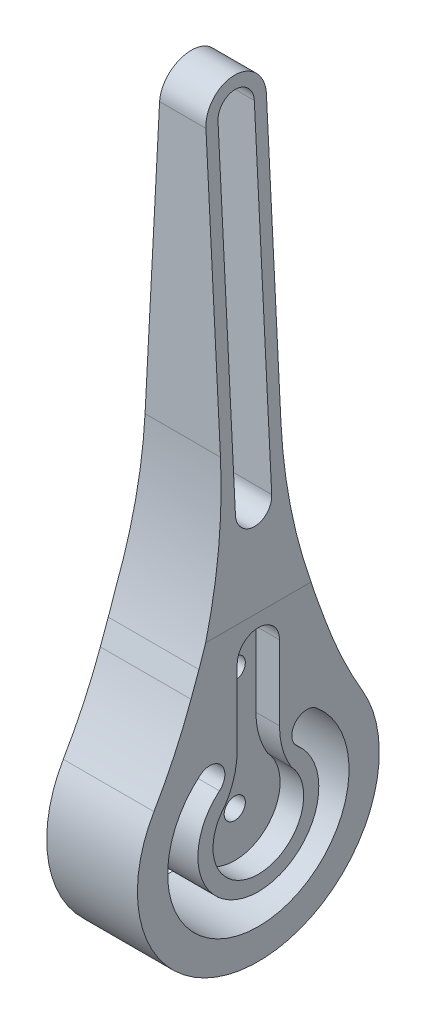
from build123d import *

# Parameters (mm, degrees)
BOSS_EXTRUDE1_DEPTH     = 15
CUT_EXTRUDE1_DEPTH      = 3.9
SKETCH4_R               = 1.75
CUT_EXTRUDE2_DEPTH      = 108.462598145
CUT_EXTRUDE3_DEPTH      = 108.935165725
CUT_EXTRUDE3_DEPTH_BACK = 108.935165725
CUT_EXTRUDE5_DEPTH      = 108.935165725


with BuildPart() as part:
    # Sketch2 → Boss-Extrude1 (new body)
    with BuildSketch(Plane.YZ):
        with BuildLine():
            Line((54.106158457, 5), (100, 5))
            ThreePointArc((100, 5), (105, 0), (100, -5))
            Line((100, -5), (54.106158457, -5))
            ThreePointArc((54.106158457, -5), (40.214304243, -6.215379759), (26.744546991, -9.824590337))
            Line((26.744546991, -9.824590337), (23.135674536, -11.13811249))
            ThreePointArc((23.135674536, -11.13811249), (16.479451078, -13.906430601), (10.0994572, -17.262704431))
            ThreePointArc((10.0994572, -17.262704431), (-20, 0), (10.0994572, 17.262704431))
            ThreePointArc((10.0994572, 17.262704431), (16.479451078, 13.906430601), (23.135674536, 11.13811249))
            Line((23.135674536, 11.13811249), (26.744546991, 9.824590337))
            ThreePointArc((26.744546991, 9.824590337), (40.214304243, 6.215379759), (54.106158457, 5))
        make_face()
        with BuildLine():
            Line((45, 3), (100, 3))
            ThreePointArc((100, 3), (103, 0), (100, -3))
            Line((100, -3), (45, -3))
            ThreePointArc((45, -3), (42, 0), (45, 3))
        make_face(mode=Mode.SUBTRACT)
    extrude(amount=-BOSS_EXTRUDE1_DEPTH)

    # Sketch3 → Cut-Extrude1 (cut)
    with BuildSketch(Plane.YZ):
        with BuildLine():
            Line((24.33053856, 3.5), (12, 3.5))
            ThreePointArc((12, 3.5), (8.440790603, 3.996719292), (5.153570125, 5.448918697))
            ThreePointArc((5.153570125, 5.448918697), (-7.5, 0), (5.153570125, -5.448918697))
            ThreePointArc((5.153570125, -5.448918697), (8.440790603, -3.996719292), (12, -3.5))
            Line((12, -3.5), (24.33053856, -3.5))
            ThreePointArc((24.33053856, -3.5), (27.83053856, 0), (24.33053856, 3.5))
        make_face()
    extrude(amount=-CUT_EXTRUDE1_DEPTH, mode=Mode.SUBTRACT)

    # Sketch4 → Cut-Extrude2 (cut, through all)
    with BuildSketch(Plane.YZ.offset(-3.9)):
        with Locations(Location((20, 0, 0), (0, 0, 270))):
            Circle(SKETCH4_R)
        with Locations(Location((24, 0, 0), (0, 0, 270))):
            Circle(SKETCH4_R)
        with Locations(Location((0, 0, 0), (0, 0, 270))):
            Circle(SKETCH4_R)
    extrude(amount=-CUT_EXTRUDE2_DEPTH, mode=Mode.SUBTRACT)

    # Sketch5 → Cut-Extrude3 (cut, two sides: drawn at the far end of the back side and taken through both)
    with BuildSketch(Plane(origin=(0, 0, 0), x_dir=(0, 1, 0), z_dir=(0, 0, 1)).offset(-CUT_EXTRUDE3_DEPTH_BACK)):
        Polygon((30, 15), (105, 11.069416554), (105, 15), align=None)
        Polygon((105, 0), (105, 3.930583446), (30, 0), align=None)
    extrude(amount=CUT_EXTRUDE3_DEPTH + CUT_EXTRUDE3_DEPTH_BACK, mode=Mode.SUBTRACT)

    # Sketch8 → Cut-Extrude5 (cut, through all)
    with BuildSketch(Plane.YZ):
        with BuildLine():
            ThreePointArc((11.490666647, 9.641814145), (-15, 0), (11.490666647, -9.641814145))
            ThreePointArc((11.490666647, -9.641814145), (11.182524563, -6.119734013), (7.660444431, -6.427876097))
            ThreePointArc((7.660444431, -6.427876097), (-10, 0), (7.660444431, 6.427876097))
            ThreePointArc((7.660444431, 6.427876097), (11.182524563, 6.119734013), (11.490666647, 9.641814145))
        make_face()
    extrude(amount=-CUT_EXTRUDE5_DEPTH, mode=Mode.SUBTRACT)


solid = part.part
